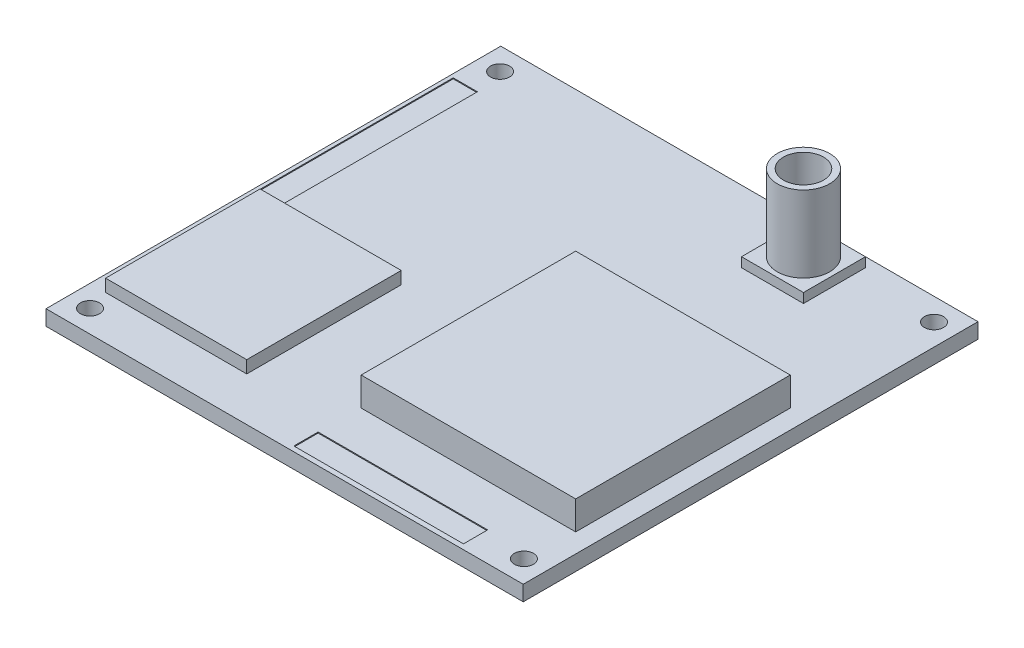
from build123d import *

# Parameters (mm, degrees)
SKETCH_2_W          = 50.043
SKETCH_2_H          = 47.687
EXTRUDE_1_DEPTH     = 1.6
SKETCH_3_R          = 1
CUT_EXTRUDE_1_DEPTH = 1.6
SKETCH_4_W          = 22.5
SKETCH_4_H          = 22.5
EXTRUDE_2_DEPTH     = 3
SKETCH_5_W          = 14.8
SKETCH_5_H          = 16.2
EXTRUDE_3_DEPTH     = 1.3
SKETCH_6_W          = 2.54
SKETCH_6_H          = 20.32
SKETCH_6_W_2        = 17.78
SKETCH_6_H_2        = 2.54
CUT_EXTRUDE_2_DEPTH = 0.1
SKETCH_7_W          = 6.5
SKETCH_7_H          = 6.5
EXTRUDE_4_DEPTH     = 1
SKETCH_8_R          = 2.75
EXTRUDE_5_DEPTH     = 8
SKETCH_9_R          = 2.1
CUT_EXTRUDE_3_DEPTH = 3


with BuildPart() as part:
    # 草图2 → 凸台-拉伸1 (new body)
    with BuildSketch(Plane(origin=(0, 0, 0), x_dir=(1, 0, 0), z_dir=(0, 1, 0))):
        Rectangle(SKETCH_2_W, SKETCH_2_H)
    extrude(amount=EXTRUDE_1_DEPTH)

    # 草图3 → 切除-拉伸1 (cut)
    with BuildSketch(Plane(origin=(0, 1.6, 0), x_dir=(1, 0, 0), z_dir=(0, 1, 0))):
        with Locations(Location((-22.75, 21.5, 0), (0, 0, 270))):
            Circle(SKETCH_3_R)
        with Locations(Location((22.75, 21.5, 0), (0, 0, 90))):
            Circle(SKETCH_3_R)
        with Locations(Location((22.75, -21.5, 0), (0, 0, 270))):
            Circle(SKETCH_3_R)
        with Locations(Location((-22.75, -21.5, 0), (0, 0, 90))):
            Circle(SKETCH_3_R)
    extrude(amount=-CUT_EXTRUDE_1_DEPTH, mode=Mode.SUBTRACT)

    # 草图4 → 凸台-拉伸2 (add)
    with BuildSketch(Plane(origin=(0, 1.6, 0), x_dir=(1, 0, 0), z_dir=(0, 1, 0))):
        with Locations((11.7715, -5.0935)):
            Rectangle(SKETCH_4_W, SKETCH_4_H)
    extrude(amount=EXTRUDE_2_DEPTH)

    # 草图5 → 凸台-拉伸3 (add)
    with BuildSketch(Plane(origin=(0, 1.6, 0), x_dir=(1, 0, 0), z_dir=(0, 1, 0))):
        with Locations((-15.9715, -11.1435)):
            Rectangle(SKETCH_5_W, SKETCH_5_H)
    extrude(amount=EXTRUDE_3_DEPTH)

    # 草图6 → 切除-拉伸2 (cut)
    with BuildSketch(Plane(origin=(0, 1.6, 0), x_dir=(1, 0, 0), z_dir=(0, 1, 0))):
        with Locations((-23.3715, 8.3165)):
            Rectangle(SKETCH_6_W, SKETCH_6_H)
        with Locations((9.3315, -22.0435)):
            Rectangle(SKETCH_6_W_2, SKETCH_6_H_2)
    extrude(amount=-CUT_EXTRUDE_2_DEPTH, mode=Mode.SUBTRACT)

    # 草图7 → 凸台-拉伸4 (add)
    with BuildSketch(Plane(origin=(0, 1.6, 0), x_dir=(1, 0, 0), z_dir=(0, 1, 0))):
        with Locations((10.9715, 19.5935)):
            Rectangle(SKETCH_7_W, SKETCH_7_H)
    extrude(amount=EXTRUDE_4_DEPTH)

    # 草图8 → 凸台-拉伸5 (add)
    with BuildSketch(Plane(origin=(0, 2.6, 0), x_dir=(1, 0, 0), z_dir=(0, 1, 0))):
        with Locations(Location((10.9715, 19.5935, 0), (0, 0, 270))):
            Circle(SKETCH_8_R)
    extrude(amount=EXTRUDE_5_DEPTH)

    # 草图9 → 切除-拉伸3 (cut)
    with BuildSketch(Plane(origin=(0, 10.6, 0), x_dir=(1, 0, 0), z_dir=(0, 1, 0))):
        with Locations(Location((10.9715, 19.5935, 0), (0, 0, 270))):
            Circle(SKETCH_9_R)
    extrude(amount=-CUT_EXTRUDE_3_DEPTH, mode=Mode.SUBTRACT)


solid = part.part
